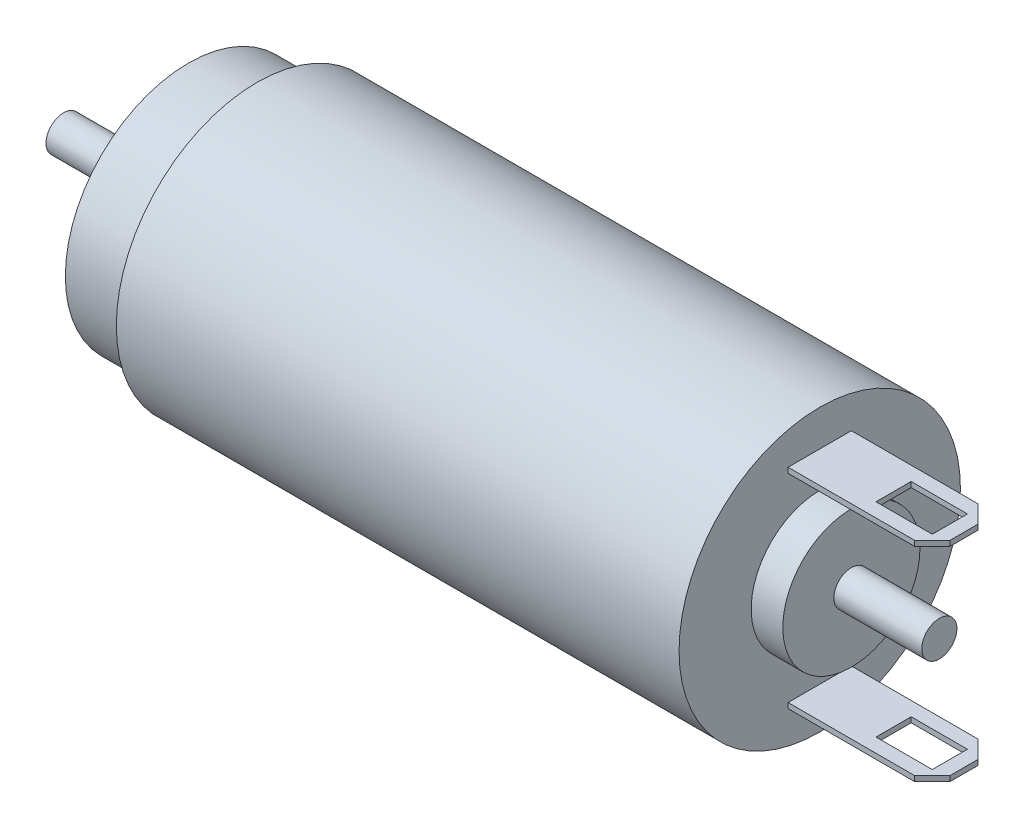
from build123d import *

# Parameters (mm, degrees)
ESBO_O1_R                        = 4
RESSALTO_EXTRUS_O1_DEPTH         = 16
ESBO_O2_R                        = 3.5
RESSALTO_EXTRUS_O2_DEPTH         = 1.95
ESBO_O4_R                        = 1.95
RESSALTO_EXTRUS_O4_DEPTH         = 0.9
ESBO_O5_R                        = 0.5
RESSALTO_EXTRUS_O5_DEPTH         = 2.5
ESBO_O6_W                        = 1.8
ESBO_O6_H                        = 0.15
RESSALTO_EXTRUS_O6_DEPTH         = 4.1
CHANFRO1_SIZE                    = 0.5
CORTE_EXTRUS_O1_REACH            = 21.667
ESBO_O7_W                        = 1.6
ESBO_O7_H                        = 1
PADR_OCIRCULAR1_COUNT            = 2
CHANFRO1_OF_PADR_OCIRCULAR1_SIZE = 0.5
ESBO_O3_R                        = 1.55
CORTE_EXTRUS_O2_DEPTH            = 0.65
RESSALTO_EXTRUS_O7_START         = 4.2
ESBO_O9_R                        = 0.5
RESSALTO_EXTRUS_O7_DEPTH         = 4.2


with BuildPart() as part:
    # Esboço1 → Ressalto-extrusão1 (new body)
    with BuildSketch(Plane(origin=(0, 0, 0), x_dir=(0, 0, -1), z_dir=(1, 0, 0))):
        Circle(ESBO_O1_R)
    extrude(amount=-RESSALTO_EXTRUS_O1_DEPTH)

    # Esboço2 → Ressalto-extrusão2 (add)
    with BuildSketch(Plane.ZY.offset(16)):
        Circle(ESBO_O2_R)
    extrude(amount=RESSALTO_EXTRUS_O2_DEPTH)

    # Esboço4 → Ressalto-extrusão4 (add)
    with BuildSketch(Plane(origin=(0, 0, 0), x_dir=(0, 0, -1), z_dir=(1, 0, 0))):
        Circle(ESBO_O4_R)
    extrude(amount=RESSALTO_EXTRUS_O4_DEPTH)

    # Esboço5 → Ressalto-extrusão5 (add)
    with BuildSketch(Plane(origin=(0.9, 0, 0), x_dir=(0, 0, -1), z_dir=(1, 0, 0))):
        Circle(ESBO_O5_R)
    extrude(amount=RESSALTO_EXTRUS_O5_DEPTH)

    # Esboço6 → Ressalto-extrusão6 (add)
    with BuildSketch(Plane(origin=(0, 0, 0), x_dir=(0, 0, -1), z_dir=(1, 0, 0))):
        with Locations((0, 2.896690855)):
            Rectangle(ESBO_O6_W, ESBO_O6_H)
    ressalto_extrus_o6 = extrude(amount=RESSALTO_EXTRUS_O6_DEPTH)

    # Chanfro1
    chanfro1_edges = [part.edges().sort_by_distance(p)[0] for p in [
        (4.1, 2.896690855, 0.9),
        (4.1, 2.896690855, -0.9),
    ]]
    chamfer(chanfro1_edges, length=CHANFRO1_SIZE)

    # Esboço7 → Corte-extrusão1 (cut, up to next)
    with BuildSketch(Plane(origin=(0, 2.971690855, 0), x_dir=(1, 0, 0), z_dir=(0, 1, 0)), mode=Mode.PRIVATE) as corte_extrus_o1_sk1:
        with Locations((2.9, 0)):
            Rectangle(ESBO_O7_W, ESBO_O7_H)
    corte_extrus_o1_tool1 = extrude(corte_extrus_o1_sk1.sketch, amount=-CORTE_EXTRUS_O1_REACH, mode=Mode.PRIVATE) & part.part
    corte_extrus_o1 = corte_extrus_o1_tool1.solids().sort_by_distance((2.9, 2.971691, 0))[0]
    add(corte_extrus_o1, mode=Mode.SUBTRACT)

    # PadrãoCircular1: Ressalto-extrusão6, Corte-extrusão1 ×2 about axis
    padr_ocircular1_axis = Axis((0, 0, 0), (1, 0, 0))
    add([ressalto_extrus_o6.rotate(padr_ocircular1_axis, i * 360 / PADR_OCIRCULAR1_COUNT) for i in range(1, PADR_OCIRCULAR1_COUNT)])
    add([corte_extrus_o1.rotate(padr_ocircular1_axis, i * 360 / PADR_OCIRCULAR1_COUNT) for i in range(1, PADR_OCIRCULAR1_COUNT)], mode=Mode.SUBTRACT)

    # Chanfro1 of PadrãoCircular1
    chanfro1_of_padr_ocircular1_edges = [part.edges().sort_by_distance(p)[0] for p in [
        (4.1, -2.896690855, -0.9),
        (4.1, -2.896690855, 0.9),
    ]]
    chamfer(chanfro1_of_padr_ocircular1_edges, length=CHANFRO1_OF_PADR_OCIRCULAR1_SIZE)

    # Esboço3 → Corte-extrusão2 (cut)
    with BuildSketch(Plane.ZY.offset(17.95)):
        Circle(ESBO_O3_R)
    extrude(amount=-CORTE_EXTRUS_O2_DEPTH, mode=Mode.SUBTRACT)

    # Esboço9 → Ressalto-extrusão7 (add)
    with BuildSketch(Plane.ZY.offset(17.3).offset(RESSALTO_EXTRUS_O7_START)):
        with Locations(Location((0, 0, 0), (0, 0, 180))):
            Circle(ESBO_O9_R)
    extrude(amount=-RESSALTO_EXTRUS_O7_DEPTH)


solid = part.part
